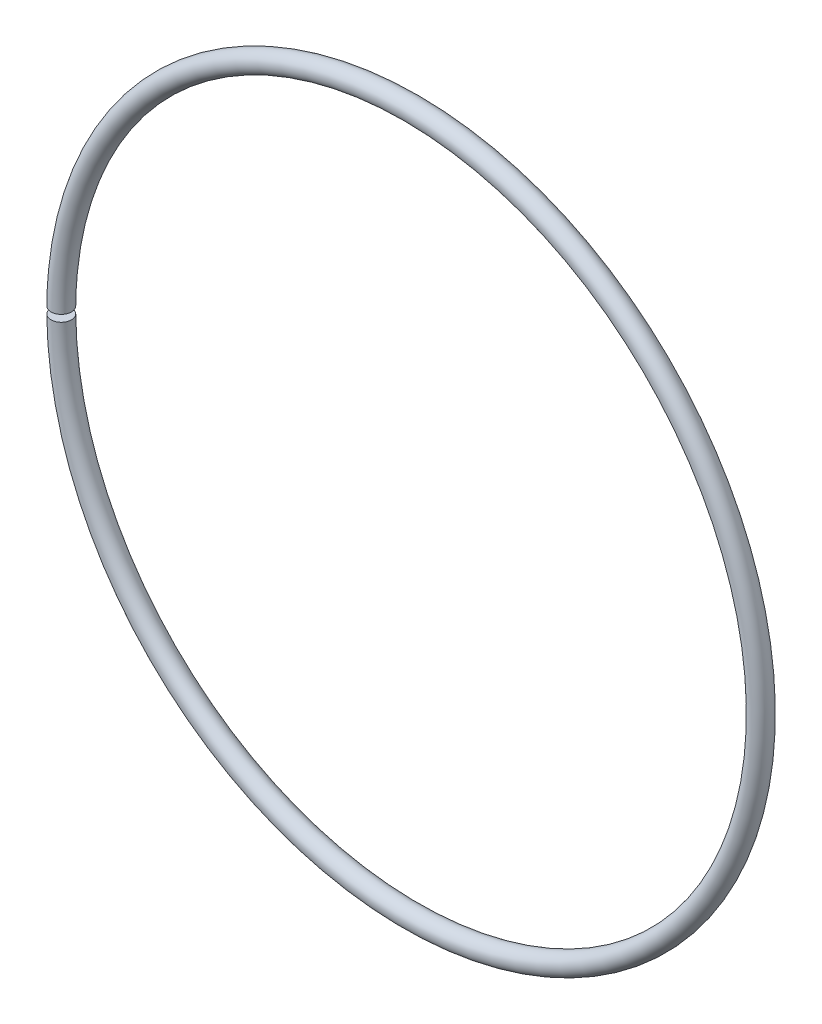
from build123d import *

# Parameters (mm, degrees)
SKETCH3_R               = 0.75
CUT_EXTRUDE1_DEPTH      = 38.27207414
CUT_EXTRUDE1_DEPTH_BACK = 38.27207414


with BuildPart() as part:
    # Sweep1: sweep along a path in Sketch1
    with BuildLine(Plane.XY) as sweep1_path:
        CenterArc((0, 0), 25.6, 0, 360)
    # Sketch3 → Sweep1 (sweep)
    with BuildSketch(Plane(origin=(0, 0, 0), x_dir=(1, 0, 0), z_dir=(0, 1, 0))):
        with Locations((-25.6, 0)):
            Circle(SKETCH3_R)
    sweep(path=sweep1_path.line)

    # Sketch4 → Cut-Extrude1 (cut, two sides: drawn at the far end of the back side and taken through both)
    with BuildSketch(Plane.XY.offset(-CUT_EXTRUDE1_DEPTH_BACK)):
        Polygon((0, 0), (0, 0.25), (-28, 0.25), (-28, -0.25), (0, -0.25), align=None)
    extrude(amount=CUT_EXTRUDE1_DEPTH + CUT_EXTRUDE1_DEPTH_BACK, mode=Mode.SUBTRACT)


solid = part.part
